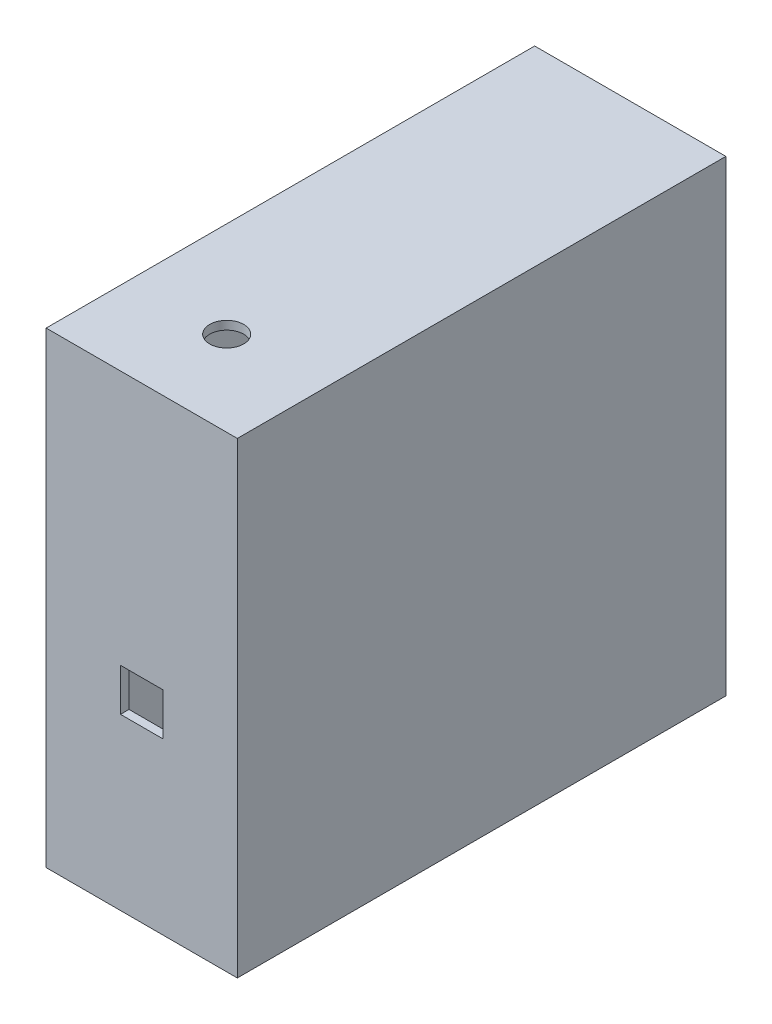
from build123d import *

# Parameters (mm, degrees)
SKETCH1_W           = 110
SKETCH1_H           = 45
BOSS_EXTRUDE1_DEPTH = 115
SHELL1_T            = -2
CUT_EXTRUDE1_REACH  = 167.378
SKETCH2_R           = 16.5
CUT_EXTRUDE2_REACH  = 167.378
SKETCH3_W           = 10
SKETCH3_H           = 10
CUT_EXTRUDE3_REACH  = 167.378
SKETCH4_R           = 4


with BuildPart() as part:
    # Sketch1 → Boss-Extrude1 (new body)
    with BuildSketch(Plane(origin=(0, 0, 0), x_dir=(0, 1, 0), z_dir=(0, 0, 1))):
        with Locations((55, 22.5)):
            Rectangle(SKETCH1_W, SKETCH1_H)
    extrude(amount=BOSS_EXTRUDE1_DEPTH)

    # Shell1
    shell1_openings = [part.faces().sort_by_distance(p)[0] for p in [
        (-22.5, 55, 0),
    ]]
    offset(amount=SHELL1_T, openings=shell1_openings, kind=Kind.INTERSECTION)

    # Sketch2 → Cut-Extrude1 (cut, up to next)
    with BuildSketch(Plane.XZ, mode=Mode.PRIVATE) as cut_extrude1_sk1:
        with Locations(Location((-22.5, 25, 0), (0, 0, 270))):
            Circle(SKETCH2_R)
    cut_extrude1_tool1 = extrude(cut_extrude1_sk1.sketch, amount=-CUT_EXTRUDE1_REACH, mode=Mode.PRIVATE) & part.part
    add(cut_extrude1_tool1.solids().sort_by_distance((-22.5, 0, 25))[0], mode=Mode.SUBTRACT)

    # Sketch3 → Cut-Extrude2 (cut, up to next)
    with BuildSketch(Plane.XY.offset(115), mode=Mode.PRIVATE) as cut_extrude2_sk1:
        with Locations((-22.5, 45)):
            Rectangle(SKETCH3_W, SKETCH3_H)
    cut_extrude2_tool1 = extrude(cut_extrude2_sk1.sketch, amount=-CUT_EXTRUDE2_REACH, mode=Mode.PRIVATE) & part.part
    add(cut_extrude2_tool1.solids().sort_by_distance((-22.5, 45, 115))[0], mode=Mode.SUBTRACT)

    # Sketch4 → Cut-Extrude3 (cut, up to next)
    with BuildSketch(Plane(origin=(0, 110, 0), x_dir=(-1, 0, 0), z_dir=(0, 1, 0)), mode=Mode.PRIVATE) as cut_extrude3_sk1:
        with Locations((22.5, 95)):
            Circle(SKETCH4_R)
    cut_extrude3_tool1 = extrude(cut_extrude3_sk1.sketch, amount=-CUT_EXTRUDE3_REACH, mode=Mode.PRIVATE) & part.part
    add(cut_extrude3_tool1.solids().sort_by_distance((-22.5, 110, 95))[0], mode=Mode.SUBTRACT)


solid = part.part
